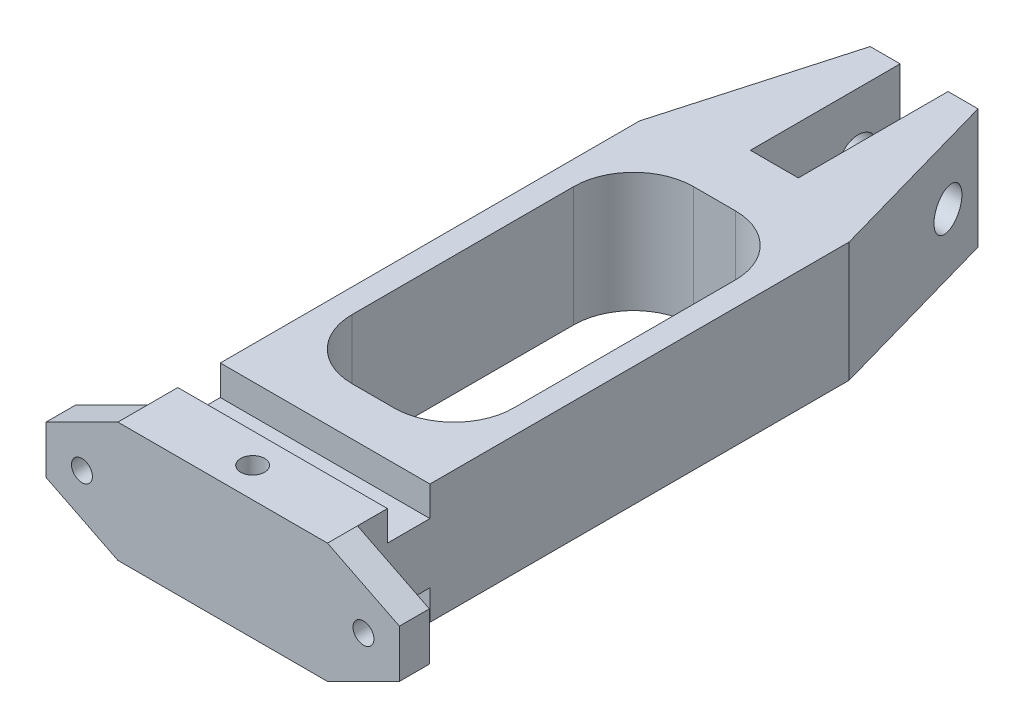
from build123d import *

# Parameters (mm, degrees)
CROQUIS1_R                 = 3.25
SALIENTE_EXTRUIR1_DEPTH    = 35
CORTAR_EXTRUIR1_REACH      = 125.844
CROQUIS2_W                 = 8
CROQUIS2_H                 = 25
CROQUIS4_W                 = 27
CROQUIS4_H                 = 57
CORTAR_EXTRUIR2_DEPTH      = 124.844297406
CORTAR_EXTRUIR3_REACH      = 125.844
CROQUIS9_R                 = 1.75
SALIENTE_EXTRUIR3_DEPTH    = 5
CHAFL_N1_SIZE              = 1.5
CHAFL_N1_OF_SIMETR_A3_SIZE = 1.5
ENGANCHE_REACH             = 129.755
CROQUIS7_R                 = 2
REDONDEO1_R                = 10


with BuildPart() as part:
    # Croquis1 → Saliente-Extruir1 (new body)
    with BuildSketch(Plane(origin=(0, 0, 0), x_dir=(0, 0, -1), z_dir=(1, 0, 0))):
        Polygon((0, 10), (0, -10), (10, -10), (10, -5), (17.1, -5), (17.1, -10), (117.1, -10), (117.1, 10), (17.1, 10), (17.1, 5), (10, 5), (10, 10), align=None)
        with Locations((110.1, 0)):
            Circle(CROQUIS1_R, mode=Mode.SUBTRACT)
    extrude(amount=SALIENTE_EXTRUIR1_DEPTH)

    # Croquis2 → Cortar-Extruir1 (cut, up to next)
    with BuildSketch(Plane(origin=(0, 10, 0), x_dir=(1, 0, 0), z_dir=(0, 1, 0)), mode=Mode.PRIVATE) as cortar_extruir1_sk1:
        with Locations((17.5, 104.6)):
            Rectangle(CROQUIS2_W, CROQUIS2_H)
    cortar_extruir1_tool1 = extrude(cortar_extruir1_sk1.sketch, amount=-CORTAR_EXTRUIR1_REACH, mode=Mode.PRIVATE) & part.part
    add(cortar_extruir1_tool1.solids().sort_by_distance((17.5, 10, -104.6))[0], mode=Mode.SUBTRACT)

    # Croquis4 → Cortar-Extruir2 (cut, through all)
    with BuildSketch(Plane(origin=(0, 10, 0), x_dir=(1, 0, 0), z_dir=(0, 1, 0))):
        with Locations((17.5, 53.6)):
            Rectangle(CROQUIS4_W, CROQUIS4_H)
    extrude(amount=-CORTAR_EXTRUIR2_DEPTH, mode=Mode.SUBTRACT)

    # Croquis5 → Cortar-Extruir3 (cut, up to next)
    with BuildSketch(Plane(origin=(0, 10, 0), x_dir=(1, 0, 0), z_dir=(0, 1, 0)), mode=Mode.PRIVATE) as cortar_extruir3_sk1:
        Polygon((8.5, 117.1), (0, 87.1), (0, 117.1), align=None)
    cortar_extruir3_tool1 = extrude(cortar_extruir3_sk1.sketch, amount=-CORTAR_EXTRUIR3_REACH, mode=Mode.PRIVATE) & part.part
    cortar_extruir3 = cortar_extruir3_tool1.solids().sort_by_distance((2.833333, 10, -107.1))[0]
    add(cortar_extruir3, mode=Mode.SUBTRACT)

    # Simetría1: Cortar-Extruir3 across plane
    add(cortar_extruir3.mirror(Plane(origin=(17.5, 0, 0), x_dir=(0, 0, 1), z_dir=(1, 0, 0))), mode=Mode.SUBTRACT)

    # Croquis9 → Saliente-Extruir3 (add)
    with BuildSketch(Plane.XY):
        Polygon((0, 10), (-12, 4), (-12, -4), (0, -10), align=None)
        with Locations((-6, 0)):
            Circle(CROQUIS9_R, mode=Mode.SUBTRACT)
    saliente_extruir3 = extrude(amount=-SALIENTE_EXTRUIR3_DEPTH)

    # Chaflán1
    chafl_n1_edges = [part.edges().sort_by_distance(p)[0] for p in [
        (-7.75, 0, -5),
    ]]
    chamfer(chafl_n1_edges, length=CHAFL_N1_SIZE)

    # Simetría3: Saliente-Extruir3 across plane
    add(saliente_extruir3.mirror(Plane(origin=(17.5, 0, 0), x_dir=(0, 0, 1), z_dir=(1, 0, 0))))

    # Chaflán1 of Simetría3
    chafl_n1_of_simetr_a3_edges = [part.edges().sort_by_distance(p)[0] for p in [
        (42.75, 0, -5),
    ]]
    chamfer(chafl_n1_of_simetr_a3_edges, length=CHAFL_N1_OF_SIMETR_A3_SIZE)

    # Croquis7 → Enganche (cut, up to next)
    with BuildSketch(Plane(origin=(0, 10, 0), x_dir=(1, 0, 0), z_dir=(0, 1, 0)), mode=Mode.PRIVATE) as enganche_sk1:
        with Locations(Location((17.5, 5, 0), (0, 0, 270))):
            Circle(CROQUIS7_R)
    enganche_tool1 = extrude(enganche_sk1.sketch, amount=-ENGANCHE_REACH, mode=Mode.PRIVATE) & part.part
    add(enganche_tool1.solids().sort_by_distance((17.5, 10, -5))[0], mode=Mode.SUBTRACT)

    # Redondeo1
    redondeo1_edges = [part.edges().sort_by_distance(p)[0] for p in [
        (31, 0, -82.1),
        (31, 0, -25.1),
        (4, 0, -25.1),
        (4, 0, -82.1),
    ]]
    fillet(redondeo1_edges, radius=REDONDEO1_R)


solid = part.part
